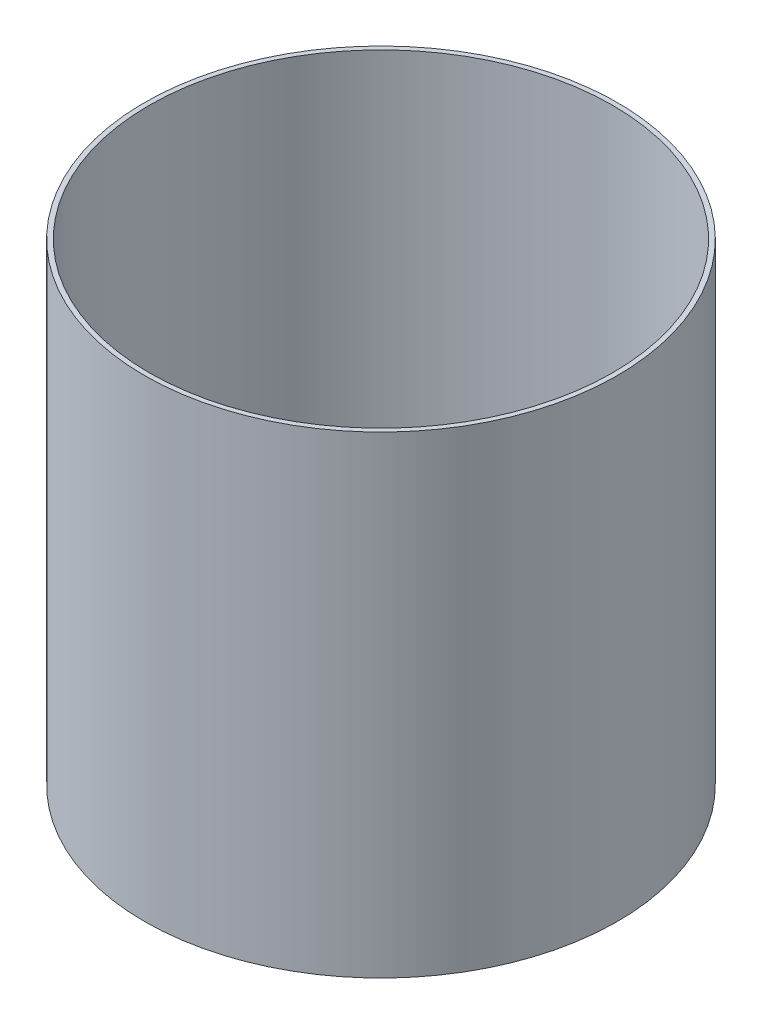
from build123d import *

# Parameters (mm, degrees)
SKETCH1_R           = 50
SKETCH1_R_2         = 49
EXTRUDE_THIN1_DEPTH = 100


with BuildPart() as part:
    # Sketch1 → Extrude-Thin1 (new body)
    with BuildSketch(Plane(origin=(0, 0, 0), x_dir=(1, 0, 0), z_dir=(0, 1, 0))):
        Circle(SKETCH1_R)
        Circle(SKETCH1_R_2, mode=Mode.SUBTRACT)
    extrude(amount=EXTRUDE_THIN1_DEPTH)


solid = part.part
